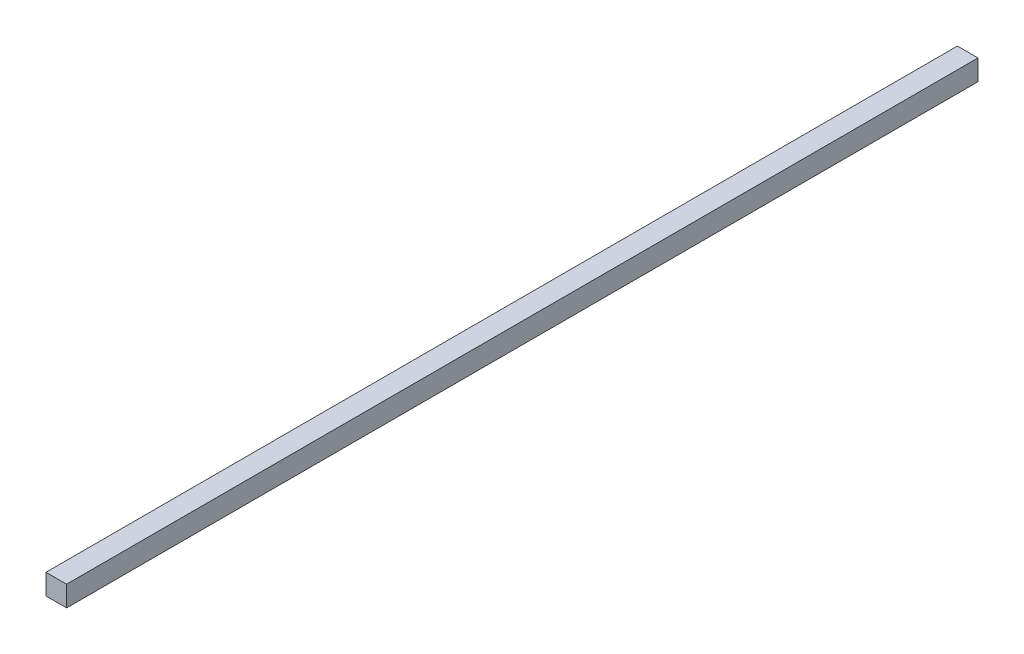
from build123d import *

# Parameters (mm, degrees)
SKETCH1_W           = 50.8
SKETCH1_H           = 50.8
BOSS_EXTRUDE1_DEPTH = 2247.9


with BuildPart() as part:
    # Sketch1 → Boss-Extrude1 (new body)
    with BuildSketch(Plane.XY):
        with Locations((719.4, -19.05)):
            Rectangle(SKETCH1_W, SKETCH1_H)
    extrude(amount=BOSS_EXTRUDE1_DEPTH)


solid = part.part
